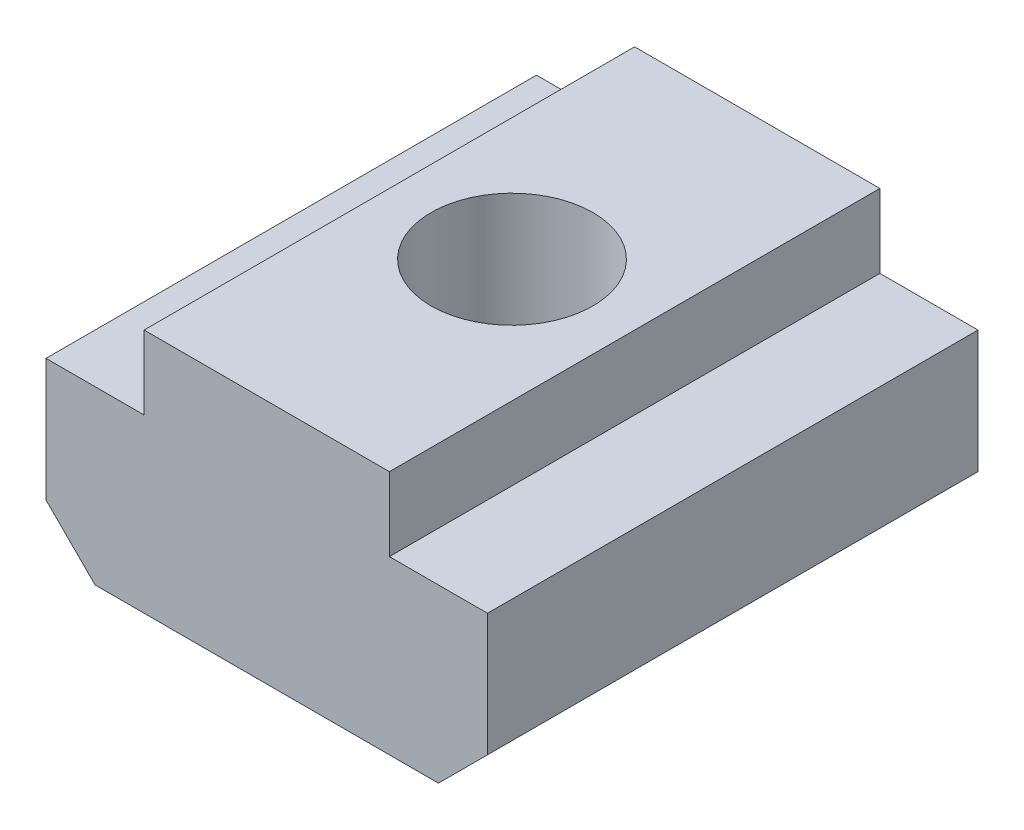
from build123d import *

# Parameters (mm, degrees)
BOSS_EXTRUDE1_DEPTH   = 10
M4X0_7_TAPPED_HOLE1_D = 3.3


with BuildPart() as part:
    # Sketch1 → Boss-Extrude1 (new body)
    with BuildSketch(Plane.XY):
        Polygon((-3.5, 0), (3.5, 0), (4.5, 1), (4.5, 3.5), (2.5, 3.5), (2.5, 5), (-2.5, 5), (-2.5, 3.5), (-4.5, 3.5), (-4.5, 1), align=None)
    extrude(amount=BOSS_EXTRUDE1_DEPTH)

    # M4x0.7 Tapped Hole1 (through all)
    with Locations(Plane(origin=(0, 5, 0), x_dir=(1, 0, 0), z_dir=(0, 1, 0))):
        with Locations((0, -5)):
            Hole(M4X0_7_TAPPED_HOLE1_D / 2)


solid = part.part
